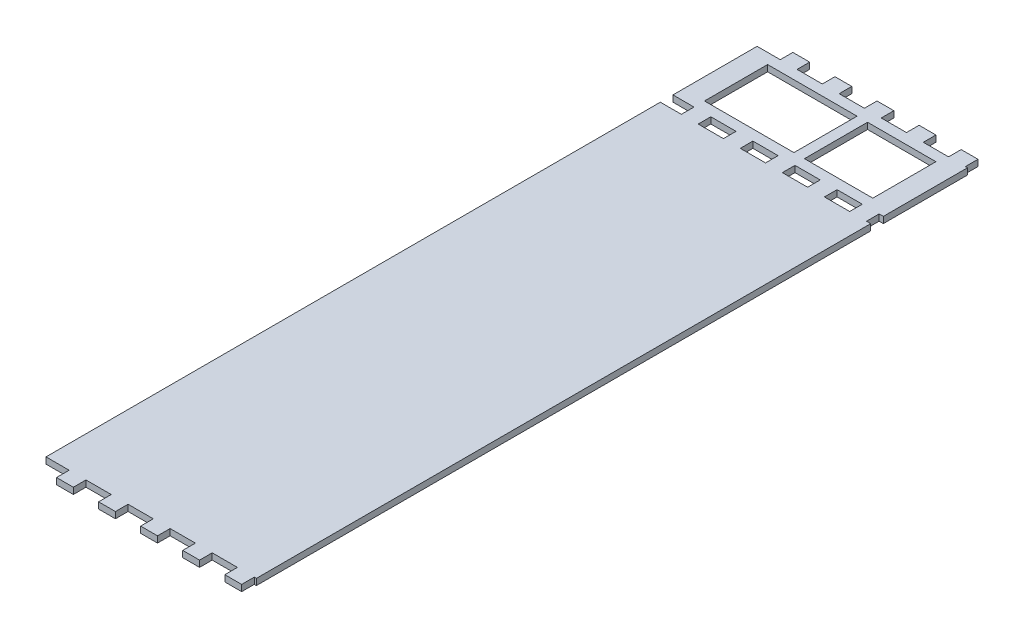
from build123d import *

# Parameters (mm, degrees)
ESQUISSE1_W             = 100
ESQUISSE1_H             = 3
BOSS_EXTRU_1_DEPTH      = 338
ESQUISSE2_W             = 12
ESQUISSE2_H             = 6
ESQUISSE2_W_2           = 2
ESQUISSE2_W_3           = 10
ENL_V_MAT_EXTRU_1_DEPTH = 6
ESQUISSE3_W             = 8
ESQUISSE3_H             = 3
BOSS_EXTRU_2_DEPTH      = 6
ESQUISSE4_W             = 42.5
ESQUISSE4_H             = 30
ESQUISSE4_W_2           = 32.5
ENL_V_MAT_EXTRU_2_DEPTH = 10


with BuildPart() as part:
    # Esquisse1 → Boss.-Extru.1 (new body)
    with BuildSketch(Plane.XY):
        with Locations((50, 1.5)):
            Rectangle(ESQUISSE1_W, ESQUISSE1_H)
    extrude(amount=BOSS_EXTRU_1_DEPTH)

    # Esquisse2 → Enlèv. mat.-Extru.1 (cut)
    with BuildSketch(Plane.XZ):
        with Locations((44, 43)):
            Rectangle(ESQUISSE2_W, ESQUISSE2_H)
        with Locations((24, 43)):
            Rectangle(ESQUISSE2_W, ESQUISSE2_H)
        with Locations((64, 43)):
            Rectangle(ESQUISSE2_W, ESQUISSE2_H)
        with Locations((84, 43)):
            Rectangle(ESQUISSE2_W, ESQUISSE2_H)
        with Locations((99, 43)):
            Rectangle(ESQUISSE2_W_2, ESQUISSE2_H)
        with Locations((5, 43)):
            Rectangle(ESQUISSE2_W_3, ESQUISSE2_H)
    extrude(amount=-ENL_V_MAT_EXTRU_1_DEPTH, mode=Mode.SUBTRACT)

    # Esquisse3 → Boss.-Extru.2 (add)
    with BuildSketch(Plane(origin=(0, 0, 0), x_dir=(-1, 0, 0), z_dir=(0, 0, -1))):
        with Locations((-15, 1.5)):
            Rectangle(ESQUISSE3_W, ESQUISSE3_H)
        with Locations((-35, 1.5)):
            Rectangle(ESQUISSE3_W, ESQUISSE3_H)
        with Locations((-55, 1.5)):
            Rectangle(ESQUISSE3_W, ESQUISSE3_H)
        with Locations((-75, 1.5)):
            Rectangle(ESQUISSE3_W, ESQUISSE3_H)
        with Locations((-95, 1.5)):
            Rectangle(ESQUISSE3_W, ESQUISSE3_H)
    boss_extru_2 = extrude(amount=BOSS_EXTRU_2_DEPTH)

    # Symétrie1: Boss.-Extru.2 across plane
    add(boss_extru_2.mirror(Plane(origin=(0, 0, 169), x_dir=(1, 0, 0), z_dir=(0, 0, -1))))

    # Esquisse4 → Enlèv. mat.-Extru.2 (cut)
    with BuildSketch(Plane.XZ):
        with Locations((31.25, 20)):
            Rectangle(ESQUISSE4_W, ESQUISSE4_H)
        with Locations((73.75, 20)):
            Rectangle(ESQUISSE4_W_2, ESQUISSE4_H)
    extrude(amount=-ENL_V_MAT_EXTRU_2_DEPTH, mode=Mode.SUBTRACT)


solid = part.part
